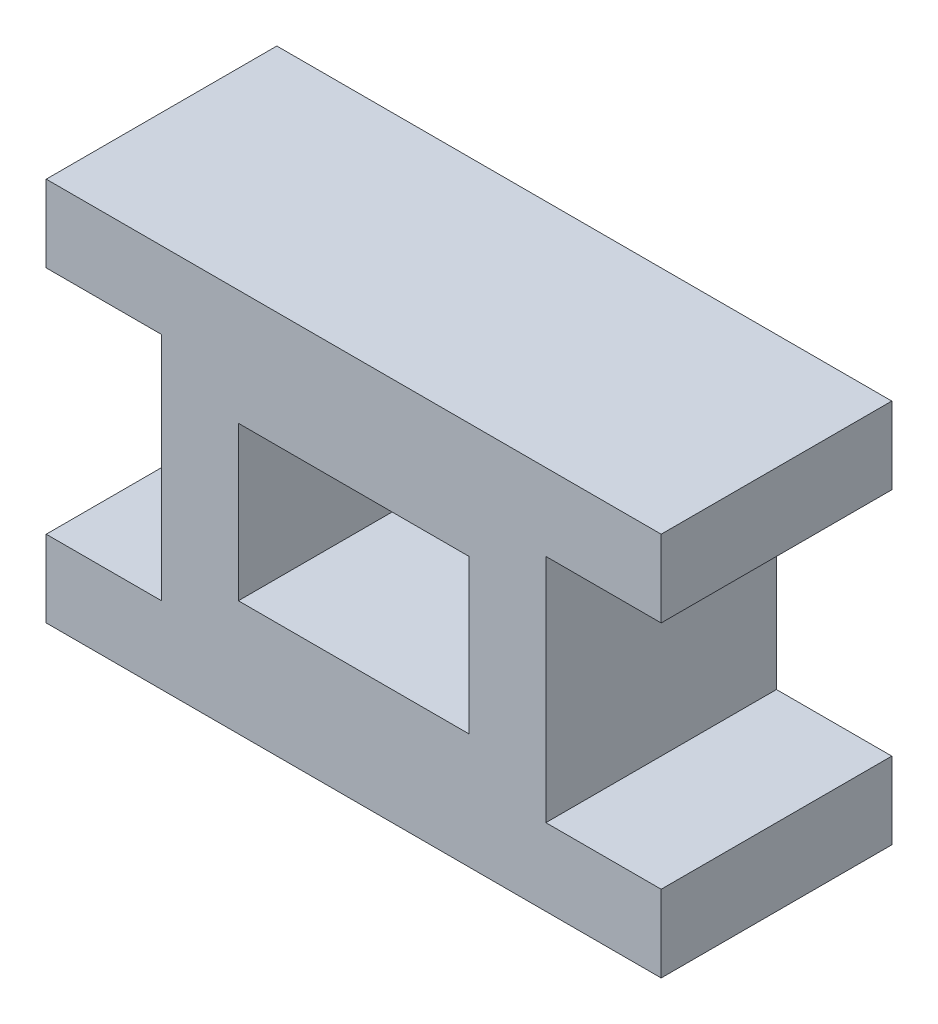
from build123d import *

# Parameters (mm, degrees)
SKETCH1_W           = 30
SKETCH1_H           = 20
BOSS_EXTRUDE1_DEPTH = 30


with BuildPart() as part:
    # Sketch1 → Boss-Extrude1 (new body)
    with BuildSketch(Plane.XY):
        Polygon((25, 10), (25, 40), (40, 40), (40, 50), (-40, 50), (-40, 40), (-25, 40), (-25, 10), (-40, 10), (-40, 0), (40, 0), (40, 10), align=None)
        with Locations((0, 25)):
            Rectangle(SKETCH1_W, SKETCH1_H, mode=Mode.SUBTRACT)
    extrude(amount=BOSS_EXTRUDE1_DEPTH)


solid = part.part
